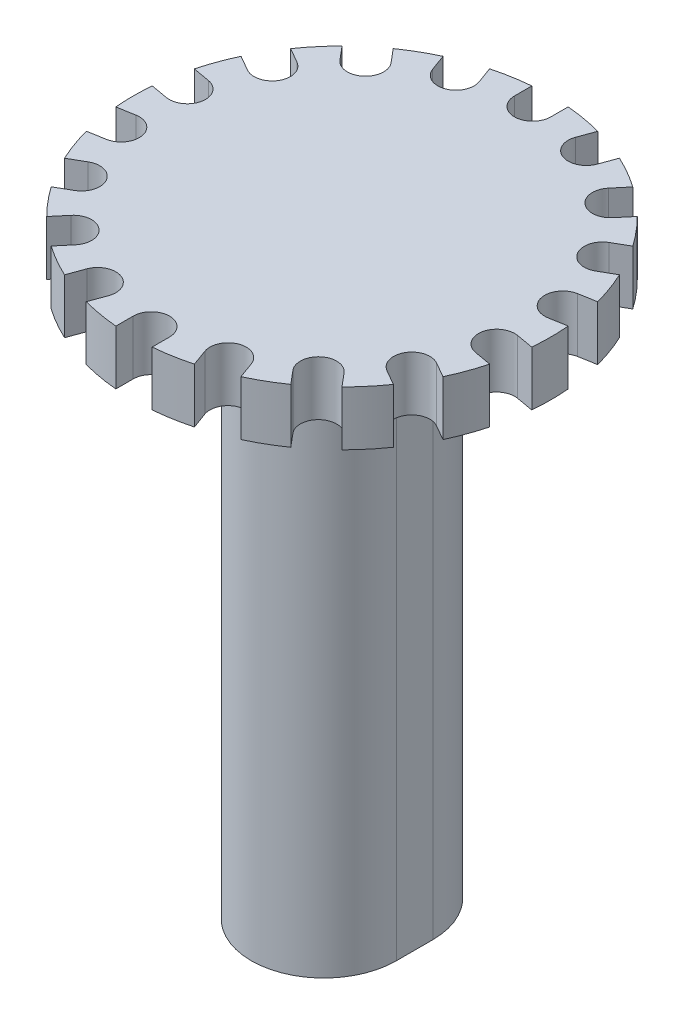
from build123d import *

# Parameters (mm, degrees)
BOSS_EXTRUDE1_DEPTH = 30
SKETCH2_R           = 11.5
BOSS_EXTRUDE2_DEPTH = 3
CUT_EXTRUDE1_DEPTH  = 37.789944278


with BuildPart() as part:
    # Sketch1 → Boss-Extrude1 (new body)
    with BuildSketch(Plane(origin=(0, 0, 0), x_dir=(1, 0, 0), z_dir=(0, 1, 0))):
        with BuildLine():
            Line((-4, -1), (-4, 1))
            ThreePointArc((-4, 1), (0, 5), (4, 1))
            Line((4, 1), (4, -1))
            ThreePointArc((4, -1), (0, -5), (-4, -1))
        make_face()
        with BuildLine():
            Line((-2, -0.8), (-2, 0.8))
            ThreePointArc((-2, 0.8), (0, 2.8), (2, 0.8))
            Line((2, 0.8), (2, -0.8))
            ThreePointArc((2, -0.8), (0, -2.8), (-2, -0.8))
        make_face(mode=Mode.SUBTRACT)
    extrude(amount=BOSS_EXTRUDE1_DEPTH)

    # Sketch2 → Boss-Extrude2 (add)
    with BuildSketch(Plane(origin=(0, 30, 0), x_dir=(1, 0, 0), z_dir=(0, 1, 0))):
        with Locations(Location((0, 0, 0), (0, 0, 270))):
            Circle(SKETCH2_R)
    extrude(amount=BOSS_EXTRUDE2_DEPTH)

    # Sketch3 → Cut-Extrude1 (cut, through all)
    with BuildSketch(Plane(origin=(0, 33, 0), x_dir=(1, 0, 0), z_dir=(0, 1, 0))):
        with BuildLine():
            Line((-1, 10.5), (-1, 17.5))
            ThreePointArc((-1, 17.5), (0, 18.5), (1, 17.5))
            Line((1, 17.5), (1, 10.5))
            ThreePointArc((1, 10.5), (0, 9.5), (-1, 10.5))
        make_face()
        with BuildLine():
            Line((2.651518884, 10.208792662), (5.045659887, 16.786641007))
            ThreePointArc((5.045659887, 16.786641007), (6.327372652, 17.384313485), (6.925045129, 16.10260072))
            Line((6.925045129, 16.10260072), (4.530904126, 9.524752375))
            ThreePointArc((4.530904126, 9.524752375), (3.249191362, 8.927079897), (2.651518884, 10.208792662))
        make_face()
        with BuildLine():
            Line((5.983225459, 8.686254262), (10.482738726, 14.048565364))
            ThreePointArc((10.482738726, 14.048565364), (11.891570779, 14.171822198), (12.014827613, 12.762990145))
            Line((12.014827613, 12.762990145), (7.515314345, 7.400679043))
            ThreePointArc((7.515314345, 7.400679043), (6.106482292, 7.27742221), (5.983225459, 8.686254262))
        make_face()
        with BuildLine():
            Line((8.59326674, 6.116025404), (14.655444566, 9.616025404))
            ThreePointArc((14.655444566, 9.616025404), (16.02146997, 9.25), (15.655444566, 7.883974596))
            Line((15.655444566, 7.883974596), (9.59326674, 4.383974596))
            ThreePointArc((9.59326674, 4.383974596), (8.227241336, 4.75), (8.59326674, 6.116025404))
        make_face()
        with BuildLine():
            Line((10.166833229, 2.808113619), (17.0604875, 4.023650862))
            ThreePointArc((17.0604875, 4.023650862), (18.218943431, 3.212491287), (17.407783855, 2.054035356))
            Line((17.407783855, 2.054035356), (10.514129584, 0.838498112))
            ThreePointArc((10.514129584, 0.838498112), (9.355673654, 1.649657688), (10.166833229, 2.808113619))
        make_face()
        with BuildLine():
            Line((10.514129584, -0.838498112), (17.407783855, -2.054035356))
            ThreePointArc((17.407783855, -2.054035356), (18.218943431, -3.212491287), (17.0604875, -4.023650862))
            Line((17.0604875, -4.023650862), (10.166833229, -2.808113619))
            ThreePointArc((10.166833229, -2.808113619), (9.355673654, -1.649657688), (10.514129584, -0.838498112))
        make_face()
        with BuildLine():
            Line((9.59326674, -4.383974596), (15.655444566, -7.883974596))
            ThreePointArc((15.655444566, -7.883974596), (16.02146997, -9.25), (14.655444566, -9.616025404))
            Line((14.655444566, -9.616025404), (8.59326674, -6.116025404))
            ThreePointArc((8.59326674, -6.116025404), (8.227241336, -4.75), (9.59326674, -4.383974596))
        make_face()
        with BuildLine():
            Line((7.515314345, -7.400679043), (12.014827613, -12.762990145))
            ThreePointArc((12.014827613, -12.762990145), (11.891570779, -14.171822198), (10.482738726, -14.048565364))
            Line((10.482738726, -14.048565364), (5.983225459, -8.686254262))
            ThreePointArc((5.983225459, -8.686254262), (6.106482292, -7.27742221), (7.515314345, -7.400679043))
        make_face()
        with BuildLine():
            Line((4.530904126, -9.524752375), (6.925045129, -16.10260072))
            ThreePointArc((6.925045129, -16.10260072), (6.327372652, -17.384313485), (5.045659887, -16.786641007))
            Line((5.045659887, -16.786641007), (2.651518884, -10.208792662))
            ThreePointArc((2.651518884, -10.208792662), (3.249191362, -8.927079897), (4.530904126, -9.524752375))
        make_face()
        with BuildLine():
            Line((1, -10.5), (1, -17.5))
            ThreePointArc((1, -17.5), (0, -18.5), (-1, -17.5))
            Line((-1, -17.5), (-1, -10.5))
            ThreePointArc((-1, -10.5), (0, -9.5), (1, -10.5))
        make_face()
        with BuildLine():
            Line((-2.651518884, -10.208792662), (-5.045659887, -16.786641007))
            ThreePointArc((-5.045659887, -16.786641007), (-6.327372652, -17.384313485), (-6.925045129, -16.10260072))
            Line((-6.925045129, -16.10260072), (-4.530904126, -9.524752375))
            ThreePointArc((-4.530904126, -9.524752375), (-3.249191362, -8.927079897), (-2.651518884, -10.208792662))
        make_face()
        with BuildLine():
            Line((-5.983225459, -8.686254262), (-10.482738726, -14.048565364))
            ThreePointArc((-10.482738726, -14.048565364), (-11.891570779, -14.171822198), (-12.014827613, -12.762990145))
            Line((-12.014827613, -12.762990145), (-7.515314345, -7.400679043))
            ThreePointArc((-7.515314345, -7.400679043), (-6.106482292, -7.27742221), (-5.983225459, -8.686254262))
        make_face()
        with BuildLine():
            Line((-8.59326674, -6.116025404), (-14.655444566, -9.616025404))
            ThreePointArc((-14.655444566, -9.616025404), (-16.02146997, -9.25), (-15.655444566, -7.883974596))
            Line((-15.655444566, -7.883974596), (-9.59326674, -4.383974596))
            ThreePointArc((-9.59326674, -4.383974596), (-8.227241336, -4.75), (-8.59326674, -6.116025404))
        make_face()
        with BuildLine():
            Line((-10.166833229, -2.808113619), (-17.0604875, -4.023650862))
            ThreePointArc((-17.0604875, -4.023650862), (-18.218943431, -3.212491287), (-17.407783855, -2.054035356))
            Line((-17.407783855, -2.054035356), (-10.514129584, -0.838498112))
            ThreePointArc((-10.514129584, -0.838498112), (-9.355673654, -1.649657688), (-10.166833229, -2.808113619))
        make_face()
        with BuildLine():
            Line((-10.514129584, 0.838498112), (-17.407783855, 2.054035356))
            ThreePointArc((-17.407783855, 2.054035356), (-18.218943431, 3.212491287), (-17.0604875, 4.023650862))
            Line((-17.0604875, 4.023650862), (-10.166833229, 2.808113619))
            ThreePointArc((-10.166833229, 2.808113619), (-9.355673654, 1.649657688), (-10.514129584, 0.838498112))
        make_face()
        with BuildLine():
            Line((-9.59326674, 4.383974596), (-15.655444566, 7.883974596))
            ThreePointArc((-15.655444566, 7.883974596), (-16.02146997, 9.25), (-14.655444566, 9.616025404))
            Line((-14.655444566, 9.616025404), (-8.59326674, 6.116025404))
            ThreePointArc((-8.59326674, 6.116025404), (-8.227241336, 4.75), (-9.59326674, 4.383974596))
        make_face()
        with BuildLine():
            Line((-7.515314345, 7.400679043), (-12.014827613, 12.762990145))
            ThreePointArc((-12.014827613, 12.762990145), (-11.891570779, 14.171822198), (-10.482738726, 14.048565364))
            Line((-10.482738726, 14.048565364), (-5.983225459, 8.686254262))
            ThreePointArc((-5.983225459, 8.686254262), (-6.106482292, 7.27742221), (-7.515314345, 7.400679043))
        make_face()
        with BuildLine():
            Line((-4.530904126, 9.524752375), (-6.925045129, 16.10260072))
            ThreePointArc((-6.925045129, 16.10260072), (-6.327372652, 17.384313485), (-5.045659887, 16.786641007))
            Line((-5.045659887, 16.786641007), (-2.651518884, 10.208792662))
            ThreePointArc((-2.651518884, 10.208792662), (-3.249191362, 8.927079897), (-4.530904126, 9.524752375))
        make_face()
    extrude(amount=-CUT_EXTRUDE1_DEPTH, mode=Mode.SUBTRACT)


solid = part.part
